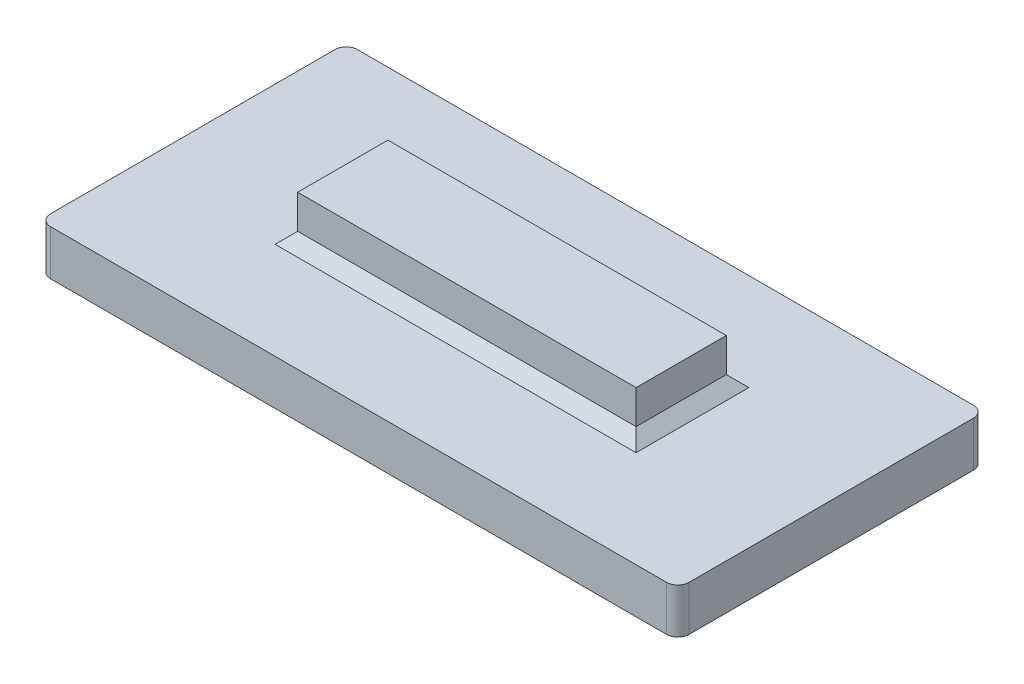
from build123d import *

# Parameters (mm, degrees)
SKETCH1_W           = 28.3
SKETCH1_H           = 13.6
BOSS_EXTRUDE1_DEPTH = 2
FILLET1_R           = 0.5
SKETCH2_W           = 15
SKETCH2_H           = 4
BOSS_EXTRUDE2_DEPTH = 2
CHAMFER1_SIZE       = 0.5


with BuildPart() as part:
    # Sketch1 → Boss-Extrude1 (new body)
    with BuildSketch(Plane(origin=(0, 0, 0), x_dir=(1, 0, 0), z_dir=(0, 1, 0))):
        Rectangle(SKETCH1_W, SKETCH1_H)
    extrude(amount=BOSS_EXTRUDE1_DEPTH)

    # Fillet1
    fillet1_edges = [part.edges().sort_by_distance(p)[0] for p in [
        (-14.15, 1, 6.8),
        (14.15, 1, 6.8),
        (14.15, 1, -6.8),
        (-14.15, 1, -6.8),
    ]]
    fillet(fillet1_edges, radius=FILLET1_R)

    # Sketch2 → Boss-Extrude2 (add)
    with BuildSketch(Plane(origin=(0, 2, 0), x_dir=(1, 0, 0), z_dir=(0, 1, 0))):
        Rectangle(SKETCH2_W, SKETCH2_H)
    extrude(amount=BOSS_EXTRUDE2_DEPTH)

    # Chamfer1
    chamfer1_edges = [part.edges().sort_by_distance(p)[0] for p in [
        (7.5, 2, 0),
        (0, 2, -2),
        (-7.5, 2, 0),
        (0, 2, 2),
    ]]
    chamfer(chamfer1_edges, length=CHAMFER1_SIZE)


solid = part.part
